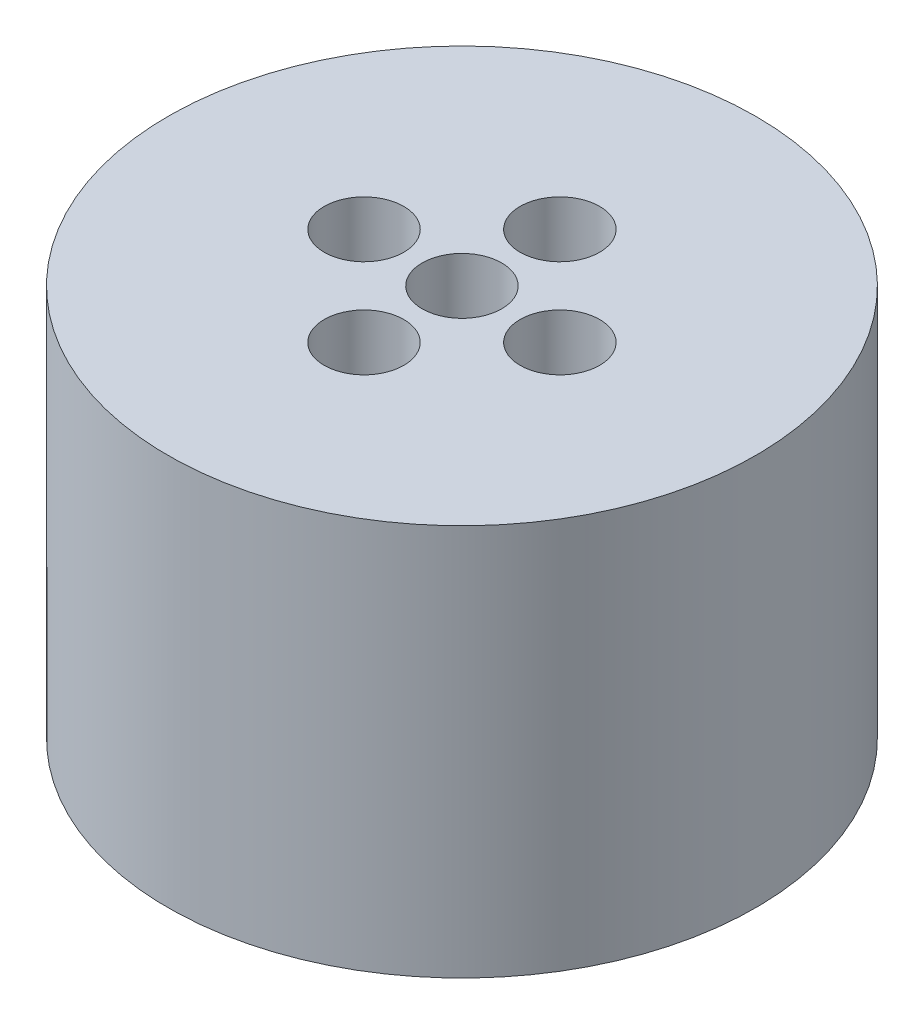
from build123d import *

# Parameters (mm, degrees)
CROQUIS1_R              = 12
CROQUIS1_R_2            = 11
SALIENTE_EXTRUIR1_DEPTH = 13
CROQUIS3_R              = 12
CROQUIS3_R_2            = 1.625
SALIENTE_EXTRUIR2_DEPTH = 3


with BuildPart() as part:
    # Croquis1 → Saliente-Extruir1 (new body)
    with BuildSketch(Plane(origin=(0, 0, 0), x_dir=(1, 0, 0), z_dir=(0, 1, 0))):
        with Locations(Location((0, 0, 0), (0, 0, 90))):
            Circle(CROQUIS1_R)
        with Locations(Location((0, 0, 0), (0, 0, 90))):
            Circle(CROQUIS1_R_2, mode=Mode.SUBTRACT)
    extrude(amount=SALIENTE_EXTRUIR1_DEPTH)

    # Croquis3 → Saliente-Extruir2 (add)
    with BuildSketch(Plane(origin=(0, 13, 0), x_dir=(1, 0, 0), z_dir=(0, 1, 0))):
        with Locations(Location((0, 0, 0), (0, 0, 90))):
            Circle(CROQUIS3_R)
        with Locations(Location((0, 0, 0), (0, 0, 270))):
            Circle(CROQUIS3_R_2, mode=Mode.SUBTRACT)
        with Locations(Location((0, 4, 0), (0, 0, 270))):
            Circle(CROQUIS3_R_2, mode=Mode.SUBTRACT)
        with Locations(Location((4, 0, 0), (0, 0, 270))):
            Circle(CROQUIS3_R_2, mode=Mode.SUBTRACT)
        with Locations(Location((0, -4, 0), (0, 0, 270))):
            Circle(CROQUIS3_R_2, mode=Mode.SUBTRACT)
        with Locations(Location((-4, 0, 0), (0, 0, 270))):
            Circle(CROQUIS3_R_2, mode=Mode.SUBTRACT)
    extrude(amount=SALIENTE_EXTRUIR2_DEPTH)


solid = part.part
